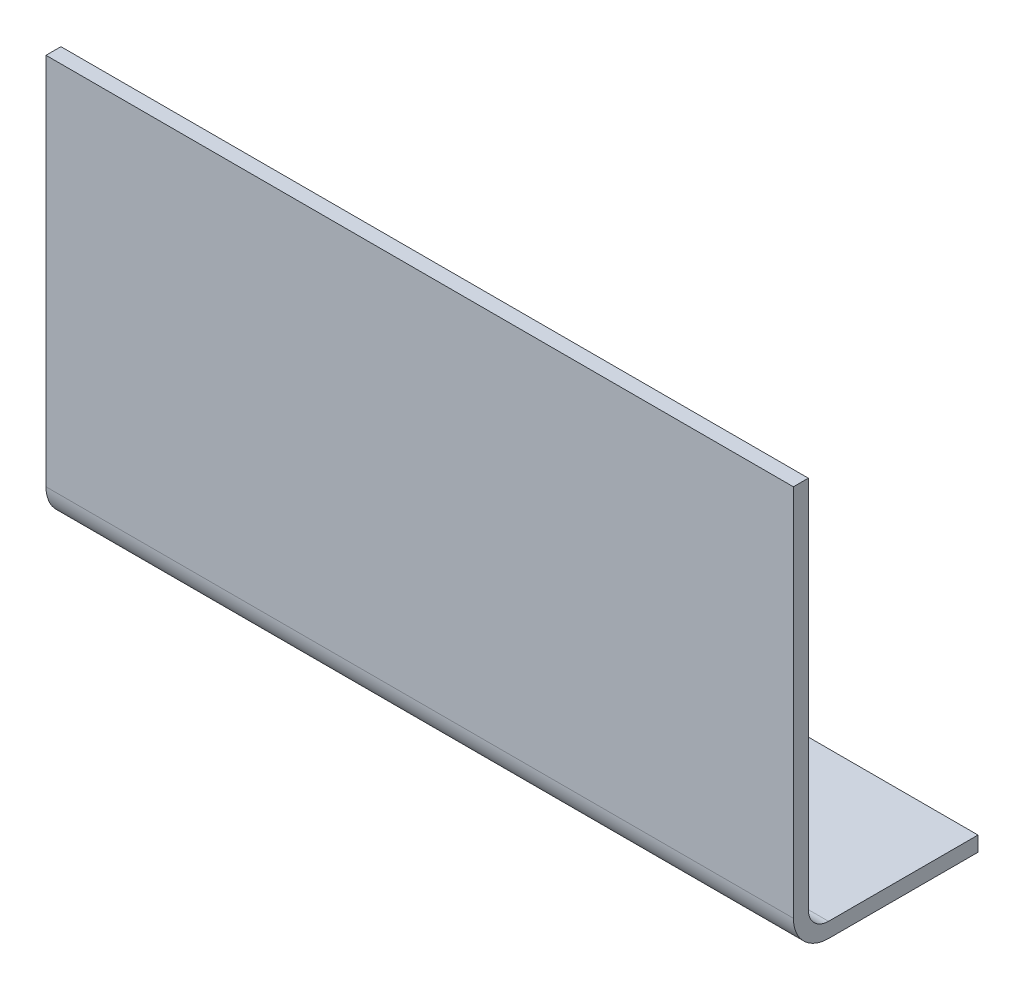
from build123d import *

# Parameters (mm, degrees)
BOSS_EXTRUDE1_DEPTH = 50


with BuildPart() as part:
    # Sketch1 → Boss-Extrude1 (new, symmetric)
    with BuildSketch(Plane(origin=(0, 0, 0), x_dir=(0, 0, -1), z_dir=(1, 0, 0))):
        with BuildLine():
            Line((-4, 3.746468452), (-4, -46.253531548))
            ThreePointArc((-4, -46.253531548), (-2.623401872, -49.57693342), (0.7, -50.953531548))
            Line((0.7, -50.953531548), (20.7, -50.953531548))
            Line((20.7, -50.953531548), (20.7, -48.953531548))
            Line((20.7, -48.953531548), (0.7, -48.953531548))
            ThreePointArc((0.7, -48.953531548), (-1.209188309, -48.162719858), (-2, -46.253531548))
            Line((-2, -46.253531548), (-2, 3.746468452))
            Line((-2, 3.746468452), (-4, 3.746468452))
        make_face()
    extrude(amount=BOSS_EXTRUDE1_DEPTH, both=True)


solid = part.part
